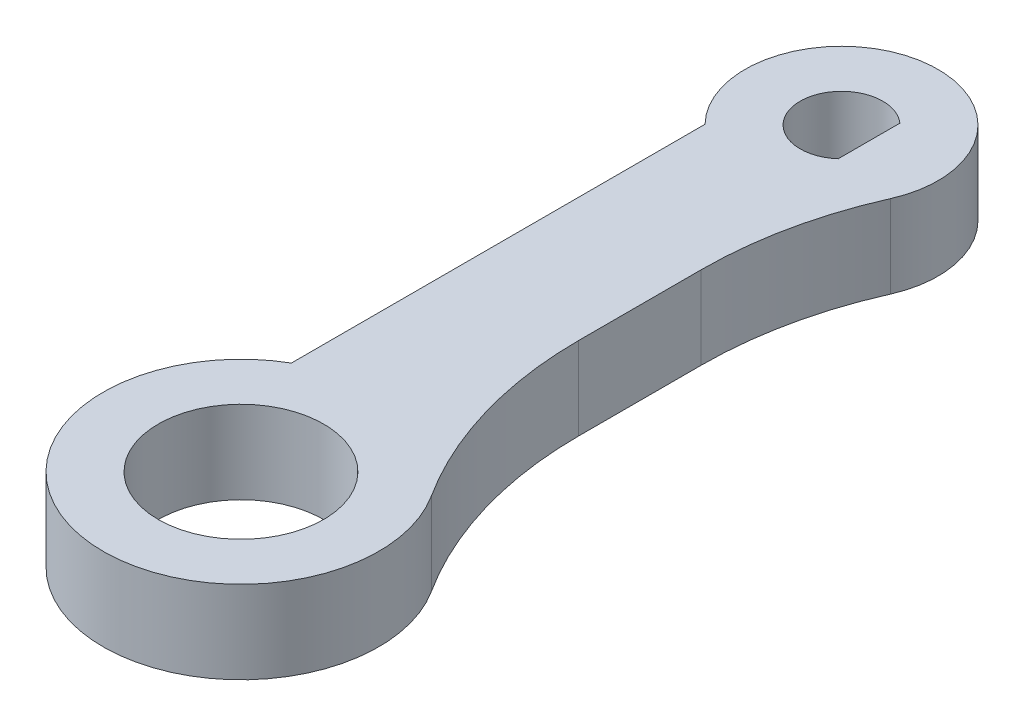
from build123d import *

# Parameters (mm, degrees)
SKETCH_2_R          = 3
EXTRUDE_1_DEPTH     = 3
CUT_EXTRUDE_1_DEPTH = 28.407077077
FILLET_1_R          = 14


with BuildPart() as part:
    # 草图2 → 凸台-拉伸1 (new body)
    with BuildSketch(Plane(origin=(0, 0, 0), x_dir=(1, 0, 0), z_dir=(0, 1, 0))):
        with BuildLine():
            ThreePointArc((2.5, -2.449489743), (0, 3.5), (-2.5, -2.449489743))
            Line((-2.5, -2.449489743), (-2.5, -17.449489743))
            ThreePointArc((-2.5, -17.449489743), (0, -26.779616762), (2.5, -17.449489743))
            Line((2.5, -17.449489743), (2.5, -2.449489743))
        make_face()
        with BuildLine():
            Line((1, 1.118033989), (1, -1.118033989))
            ThreePointArc((1, -1.118033989), (-1.5, 0), (1, 1.118033989))
        make_face(mode=Mode.SUBTRACT)
        with Locations(Location((0, -21.779616762, 0), (0, 0, 270))):
            Circle(SKETCH_2_R, mode=Mode.SUBTRACT)
    extrude(amount=EXTRUDE_1_DEPTH)

    # 草图3 → 切除-拉伸1 (cut, through all)
    with BuildSketch(Plane.XZ):
        with BuildLine():
            ThreePointArc((2.5, 17.449489743), (2.253537793, 17.31625845), (2, 17.197041067))
            Line((2, 17.197041067), (2, 2.872281323))
            ThreePointArc((2, 2.872281323), (2.259908888, 2.67260394), (2.5, 2.449489743))
            Line((2.5, 2.449489743), (2.5, 17.449489743))
        make_face()
    extrude(amount=-CUT_EXTRUDE_1_DEPTH, mode=Mode.SUBTRACT)

    # 圆角1
    fillet_1_edges = [part.edges().sort_by_distance(p)[0] for p in [
        (2, 1.5, 2.872281323),
        (2, 1.5, 17.197041067),
    ]]
    fillet(fillet_1_edges, radius=FILLET_1_R)


solid = part.part
